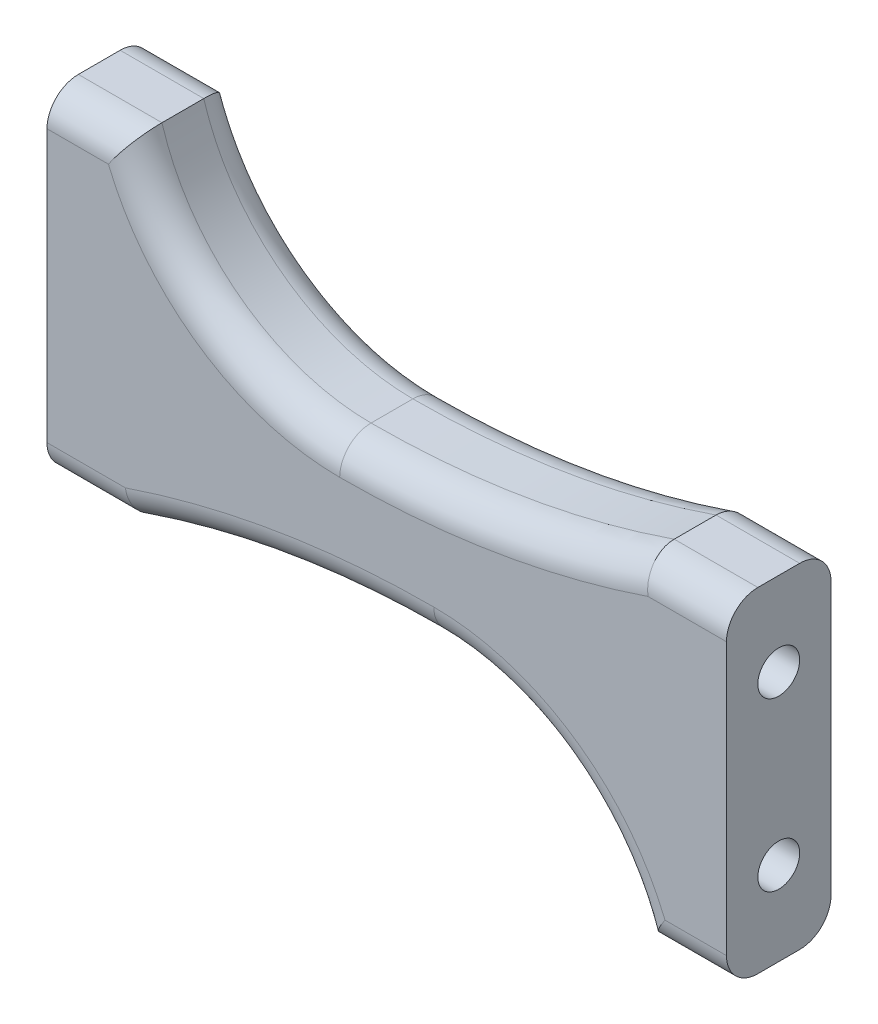
from build123d import *

# Parameters (mm, degrees)
BOSS_EXTRUDE1_DEPTH = 5
FILLET1_R           = 3
SKETCH2_R           = 2
CUT_EXTRUDE1_DEPTH  = 7
SKETCH3_R           = 2
CUT_EXTRUDE2_DEPTH  = 7


with BuildPart() as part:
    # Sketch1 → Boss-Extrude1 (new, symmetric)
    with BuildSketch(Plane.XY):
        with BuildLine():
            Line((24.49935999, -21), (32.49935999, -21))
            Line((32.49935999, -21), (32.49935999, 11))
            Line((32.49935999, 11), (24.49935999, 11))
            ThreePointArc((24.49935999, 11), (10.203242171, 7.348405073), (-4.50064001, 6.12))
            ThreePointArc((-4.50064001, 6.12), (-16.964475696, 10.248068768), (-24.5, 21))
            Line((-24.5, 21), (-32.5, 21))
            Line((-32.5, 21), (-32.5, -11))
            Line((-32.5, -11), (-24.5, -11))
            ThreePointArc((-24.5, -11), (-10.203882181, -7.348405073), (4.5, -6.12))
            ThreePointArc((4.5, -6.12), (16.963835686, -10.248068768), (24.49935999, -21))
        make_face()
    extrude(amount=BOSS_EXTRUDE1_DEPTH, both=True)

    # Fillet1
    fillet1_edges = [part.edges().sort_by_distance(p)[0] for p in [
        (28.49935999, -21, -5),
        (16.963835686, -10.248068768, -5),
        (-10.203882181, -7.348405073, -5),
        (-28.5, -11, -5),
        (-28.5, 21, -5),
        (-16.964475696, 10.248068768, -5),
        (10.203242171, 7.348405073, 5),
        (10.203242171, 7.348405073, -5),
        (28.49935999, 11, -5),
        (-16.964475696, 10.248068768, 5),
        (-28.5, 21, 5),
        (-28.5, -11, 5),
        (-10.203882181, -7.348405073, 5),
        (16.963835686, -10.248068768, 5),
        (28.49935999, -21, 5),
        (28.49935999, 11, 5),
    ]]
    fillet(fillet1_edges, radius=FILLET1_R)

    # Sketch2 → Cut-Extrude1 (cut)
    with BuildSketch(Plane(origin=(32.49935999, 0, 0), x_dir=(0, 0, -1), z_dir=(1, 0, 0))):
        with Locations((0, -13)):
            Circle(SKETCH2_R)
        with Locations((0, 3)):
            Circle(SKETCH2_R)
    extrude(amount=-CUT_EXTRUDE1_DEPTH, mode=Mode.SUBTRACT)

    # Sketch3 → Cut-Extrude2 (cut)
    with BuildSketch(Plane.ZY.offset(32.5)):
        with Locations(Location((0, 13, 0), (0, 0, 270))):
            Circle(SKETCH3_R)
        with Locations(Location((0, -3, 0), (0, 0, 270))):
            Circle(SKETCH3_R)
    extrude(amount=-CUT_EXTRUDE2_DEPTH, mode=Mode.SUBTRACT)


solid = part.part
